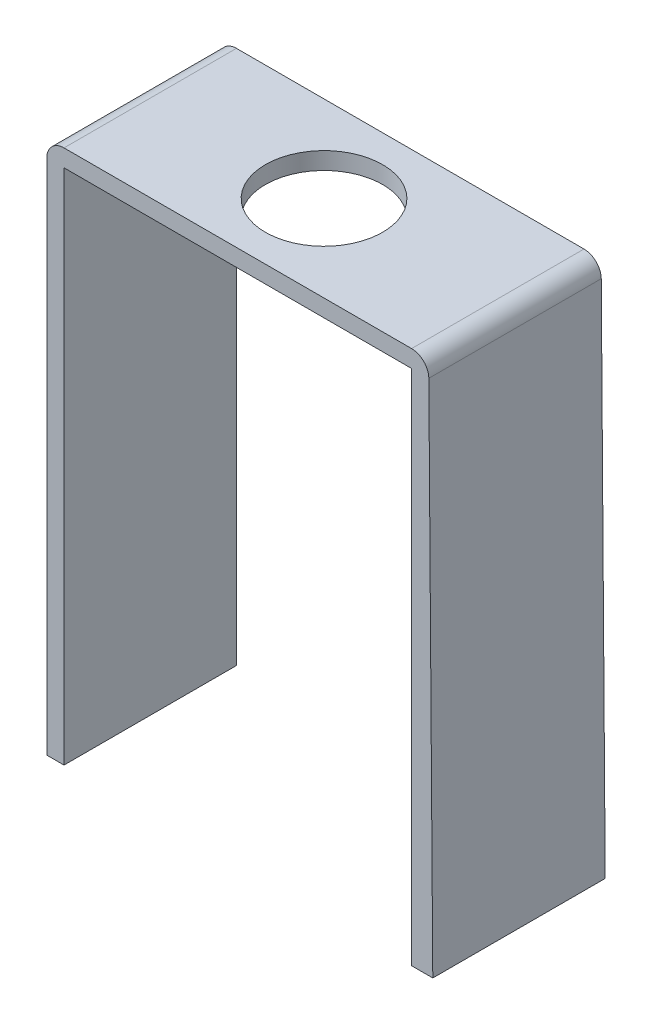
from build123d import *

# Parameters (mm, degrees)
EXTRUDE_1_DEPTH     = 20
FILLET_2_R          = 2
FILLET_4_R          = 2
SKETCH_2_R          = 6.8
CUT_EXTRUDE_2_DEPTH = 20


with BuildPart() as part:
    # 草图1 → 凸台-拉伸1 (new body)
    with BuildSketch(Plane.XY):
        Polygon((-27.351383791, 53.289188169), (-27.351383791, -8.710811831), (-25.351383791, -8.710811831), (-25.351383791, 51.289188169), (14.948616209, 51.289188169), (14.948616209, -8.710811831), (17.423079102, -8.710811831), (16.948616209, 53.289188169), align=None)
    extrude(amount=EXTRUDE_1_DEPTH)

    # 圆角2
    fillet_2_edges = [part.edges().sort_by_distance(p)[0] for p in [
        (-27.351383791, 53.289188169, 10),
    ]]
    fillet(fillet_2_edges, radius=FILLET_2_R)

    # 圆角4
    fillet_4_edges = [part.edges().sort_by_distance(p)[0] for p in [
        (16.948616209, 53.289188169, 10),
    ]]
    fillet(fillet_4_edges, radius=FILLET_4_R)

    # 草图2 → 切除-拉伸2 (cut)
    with BuildSketch(Plane(origin=(0, 53.289188169, 0), x_dir=(1, 0, 0), z_dir=(0, 1, 0))):
        with Locations(Location((-5.193760445, -10, 0), (0, 0, 180))):
            Circle(SKETCH_2_R)
    extrude(amount=-CUT_EXTRUDE_2_DEPTH, mode=Mode.SUBTRACT)


solid = part.part
